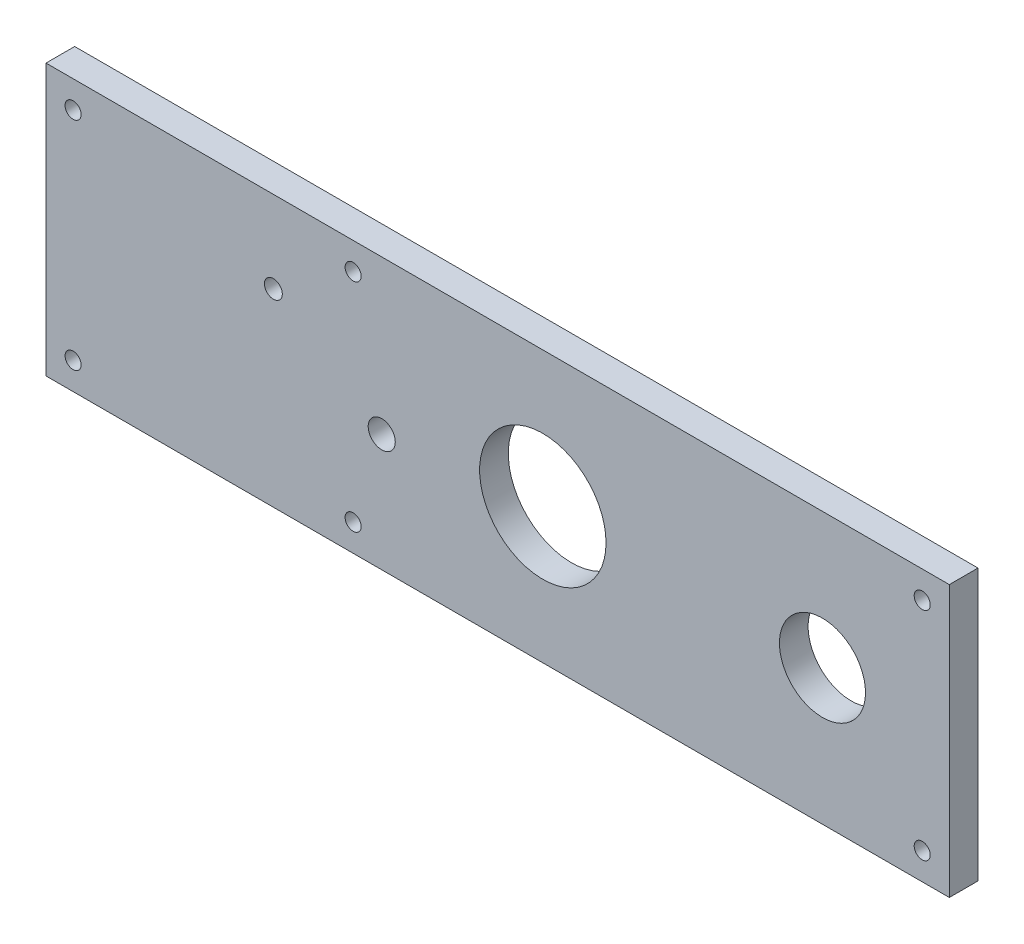
from build123d import *

# Parameters (mm, degrees)
SKETCH1_W             = 100
SKETCH1_H             = 30
SKETCH1_R             = 6.9977
SKETCH1_R_2           = 1.4986
SKETCH1_R_3           = 0.9906
BOSS_EXTRUDE2_DEPTH   = 3.175
F_2_56_TAPPED_HOLE1_D = 1.778
SKETCH4_R             = 4.7625
CUT_EXTRUDE1_DEPTH    = 105.45133137


with BuildPart() as part:
    # Sketch1 → Boss-Extrude2 (new body)
    with BuildSketch(Plane.XY):
        with Locations((50, 15)):
            Rectangle(SKETCH1_W, SKETCH1_H)
        with Locations((55, 15)):
            Circle(SKETCH1_R, mode=Mode.SUBTRACT)
        with Locations((37.166699296, 13)):
            Circle(SKETCH1_R_2, mode=Mode.SUBTRACT)
        with Locations((25.169778966, 20.933400182)):
            Circle(SKETCH1_R_3, mode=Mode.SUBTRACT)
    extrude(amount=BOSS_EXTRUDE2_DEPTH)

    # #2-56 Tapped Hole1 (through all)
    with Locations(Plane.XY.offset(3.175)):
        with Locations((97, 27), (97, 3), (3, 27), (3, 3), (34, 27), (34, 3)):
            Hole(F_2_56_TAPPED_HOLE1_D / 2)

    # Sketch4 → Cut-Extrude1 (cut, through all)
    with BuildSketch(Plane.XY.offset(3.175)):
        with Locations((85.9562, 15)):
            Circle(SKETCH4_R)
    extrude(amount=-CUT_EXTRUDE1_DEPTH, mode=Mode.SUBTRACT)


solid = part.part
